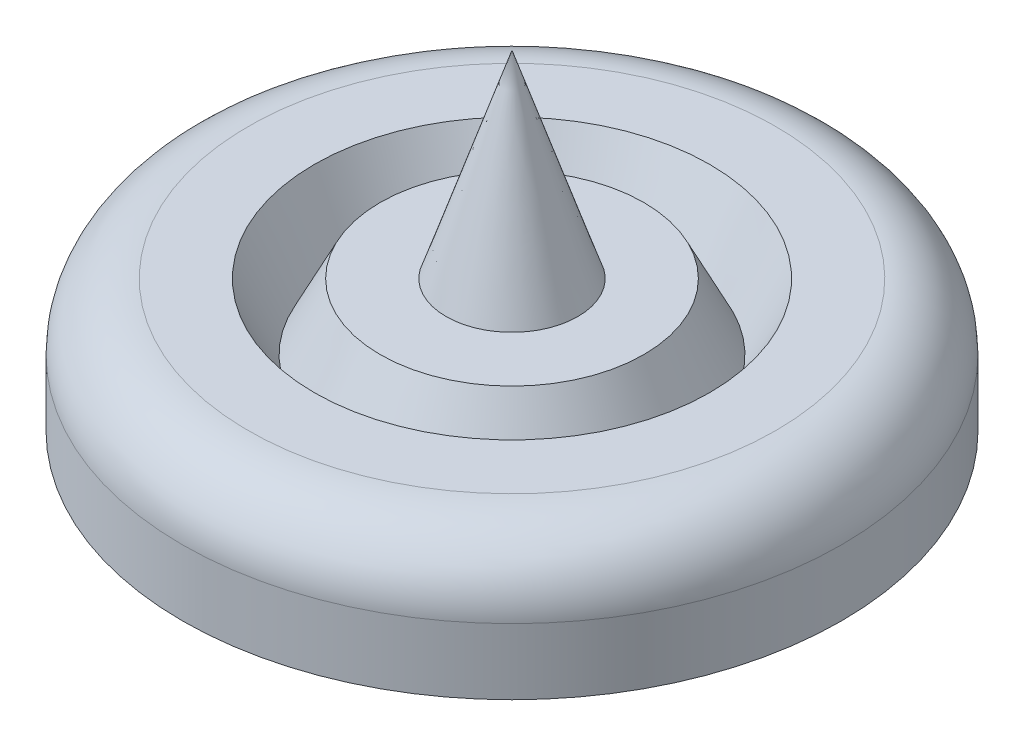
from build123d import *

# Parameters (mm, degrees)
FILLET1_R = 25.4


with BuildPart() as part:
    # Sketch1 → Revolve1 (revolve)
    with BuildSketch(Plane.XY, mode=Mode.PRIVATE) as revolve1_sk:
        Polygon((25.4, 0), (0, 25.4), (0, 127), (25.4, 50.8), (50.8, 50.8), (63.5, 25.4), (76.2, 50.8), (127, 50.8), (127, 0), align=None)
    revolve(revolve1_sk.sketch.rotate(Axis((0, 127, 0), (0, -1, 0)), 180), axis=Axis((0, 127, 0), (0, -1, 0)))

    # Fillet1
    fillet1_edges = [part.edges().sort_by_distance(p)[0] for p in [
        (127, 50.8, 0),
    ]]
    fillet(fillet1_edges, radius=FILLET1_R)


solid = part.part
